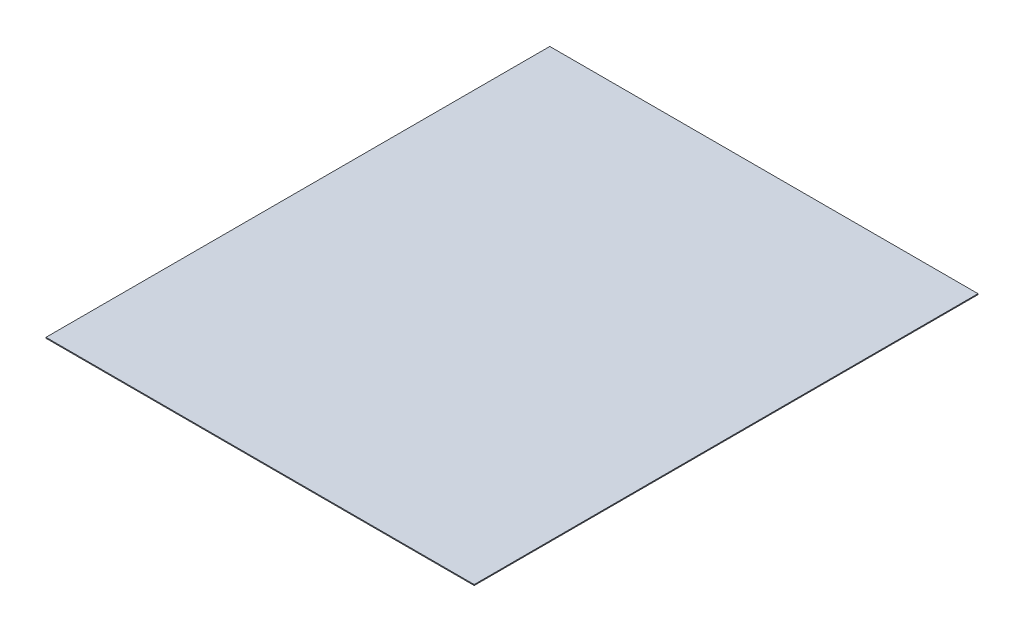
from build123d import *

# Parameters (mm, degrees)
SKETCH1_W             = 697
SKETCH1_H             = 1.5
PRESS_DIS_UST_1_DEPTH = 820


with BuildPart() as part:
    # Sketch1 → PRESS_dis_ust_1 (new body)
    with BuildSketch(Plane.XY):
        with Locations((350, 1969.25)):
            Rectangle(SKETCH1_W, SKETCH1_H)
    extrude(amount=-PRESS_DIS_UST_1_DEPTH)


solid = part.part
